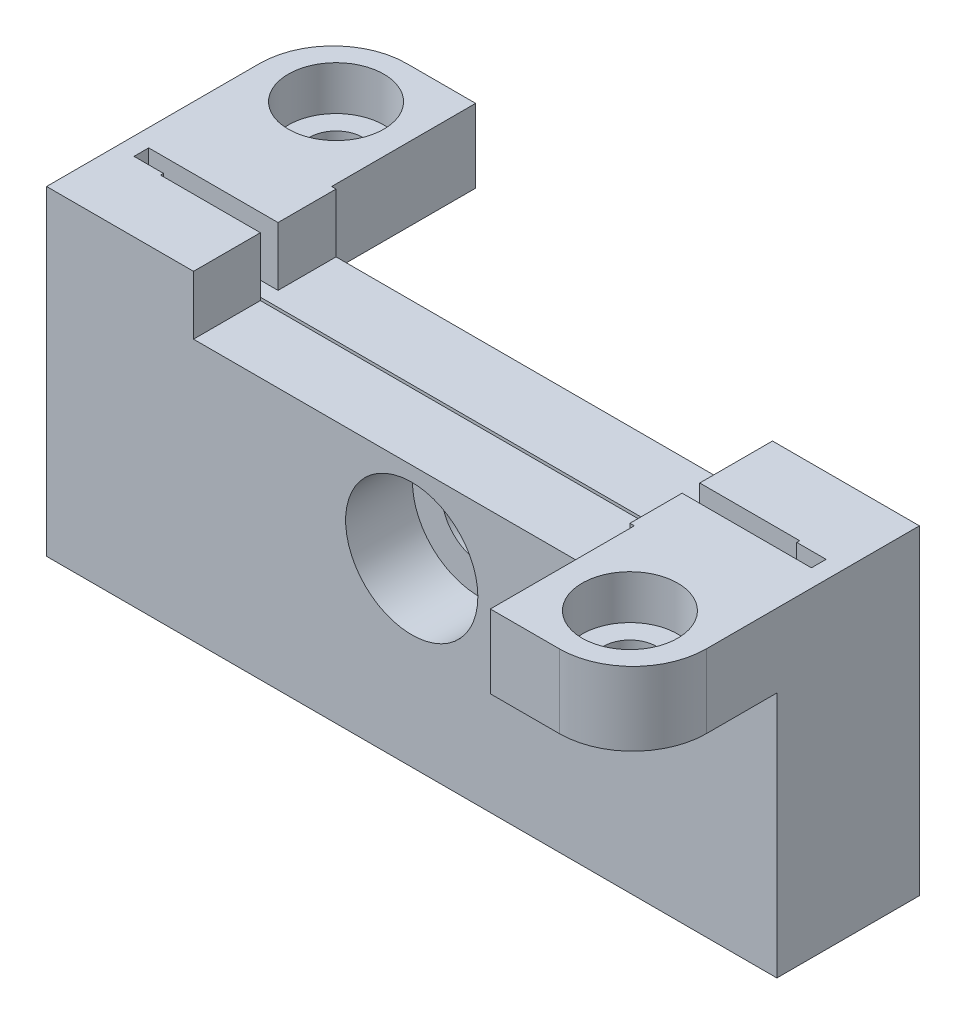
from build123d import *

# Parameters (mm, degrees)
BOSS_EXTRUDE1_DEPTH            = 4.85
SKETCH2_W                      = 43.3
SKETCH2_H                      = 0.2
CUT_EXTRUDE1_DEPTH             = 21
BOSS_EXTRUDE2_DEPTH            = 5
CBORE_FOR_M3_SHCS1_D           = 3.6
CBORE_FOR_M3_SHCS1_CBORE_D     = 6.5
CBORE_FOR_M3_SHCS1_CBORE_DEPTH = 3
CUT_EXTRUDE2_DEPTH             = 4
CUT_EXTRUDE3_REACH             = 59.668
SKETCH9_R                      = 4.5
SKETCH10_W                     = 8.8
SKETCH10_H                     = 1
CUT_EXTRUDE4_DEPTH             = 4
SKETCH11_R                     = 2.7
CUT_EXTRUDE5_DEPTH             = 0.95


with BuildPart() as part:
    # Sketch1 → Boss-Extrude1 (new, symmetric)
    with BuildSketch(Plane.XY):
        Polygon((0, 0), (0, 21.8), (10, 21.8), (10, 17.8), (39.7, 17.8), (39.7, 21.8), (49.7, 21.8), (49.7, 0), align=None)
    extrude(amount=BOSS_EXTRUDE1_DEPTH, both=True)

    # Sketch2 → Cut-Extrude1 (cut)
    with BuildSketch(Plane(origin=(0, 21.8, 0), x_dir=(1, 0, 0), z_dir=(0, 1, 0))):
        with Locations((24.85, -0.2)):
            Rectangle(SKETCH2_W, SKETCH2_H)
    extrude(amount=-CUT_EXTRUDE1_DEPTH, mode=Mode.SUBTRACT)

    # Sketch3 → Boss-Extrude2 (add)
    with BuildSketch(Plane(origin=(0, 21.8, 0), x_dir=(1, 0, 0), z_dir=(0, 1, 0))):
        with BuildLine():
            Line((0, 9.65), (0, 4.85))
            Line((0, 4.85), (9.7, 4.85))
            Line((9.7, 4.85), (9.7, 14.65))
            Line((9.7, 14.65), (5, 14.65))
            ThreePointArc((5, 14.65), (1.464466094, 13.185533906), (0, 9.65))
        make_face()
        with BuildLine():
            Line((49.7, -4.85), (40, -4.85))
            Line((40, -4.85), (40, -14.65))
            Line((40, -14.65), (44.7, -14.65))
            ThreePointArc((44.7, -14.65), (48.235533906, -13.185533906), (49.7, -9.65))
            Line((49.7, -9.65), (49.7, -4.85))
        make_face()
    extrude(amount=-BOSS_EXTRUDE2_DEPTH)

    # CBORE for M3 SHCS1 (through all)
    with Locations(Plane(origin=(0, 21.8, 0), x_dir=(1, 0, 0), z_dir=(0, 1, 0))):
        with Locations((44.85, -10), (4.85, 10)):
            CounterBoreHole(CBORE_FOR_M3_SHCS1_D / 2, CBORE_FOR_M3_SHCS1_CBORE_D / 2, CBORE_FOR_M3_SHCS1_CBORE_DEPTH)

    # Sketch7 → Cut-Extrude2 (cut)
    with BuildSketch(Plane(origin=(0, 0, -4.85), x_dir=(-1, 0, 0), z_dir=(0, 0, -1))):
        Polygon((-29.642007234, 12.3), (-27.246003617, 8.15), (-22.453996383, 8.15), (-20.057992766, 12.3), (-22.453996383, 16.45), (-27.246003617, 16.45), align=None)
    extrude(amount=-CUT_EXTRUDE2_DEPTH, mode=Mode.SUBTRACT)

    # Sketch9 → Cut-Extrude3 (cut, up to next)
    with BuildSketch(Plane.XY.offset(4.85), mode=Mode.PRIVATE) as cut_extrude3_sk1:
        with Locations((24.85, 12.3)):
            Circle(SKETCH9_R)
    cut_extrude3_tool1 = extrude(cut_extrude3_sk1.sketch, amount=-CUT_EXTRUDE3_REACH, mode=Mode.PRIVATE) & part.part
    add(cut_extrude3_tool1.solids().sort_by_distance((24.85, 12.3, 4.85))[0], mode=Mode.SUBTRACT)

    # Sketch10 → Cut-Extrude4 (cut)
    with BuildSketch(Plane(origin=(0, 21.8, 0), x_dir=(1, 0, 0), z_dir=(0, 1, 0))):
        with Locations((5.6, 0.4)):
            Rectangle(SKETCH10_W, SKETCH10_H)
        with Locations((44.1, -0.8)):
            Rectangle(SKETCH10_W, SKETCH10_H)
    extrude(amount=-CUT_EXTRUDE4_DEPTH, mode=Mode.SUBTRACT)

    # Sketch11 → Cut-Extrude5 (cut)
    with BuildSketch(Plane.XY.offset(0.1)):
        with Locations((24.85, 12.3)):
            Circle(SKETCH11_R)
    extrude(amount=-CUT_EXTRUDE5_DEPTH, mode=Mode.SUBTRACT)


solid = part.part
